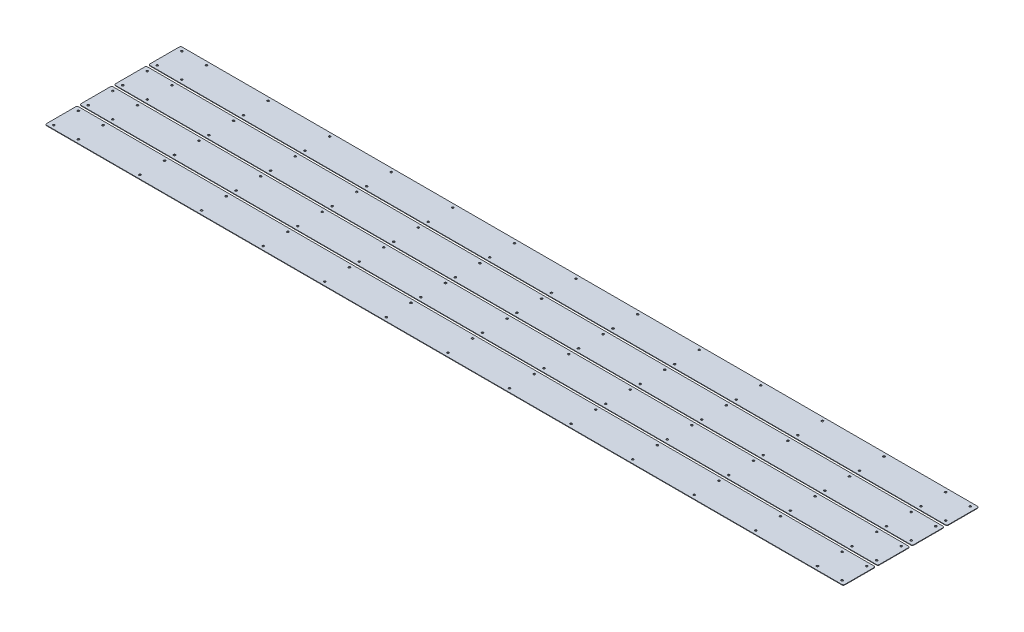
from build123d import *

# Parameters (mm, degrees)
SKETCH1_W           = 1620
SKETCH1_H           = 65
SKETCH1_R           = 2
BOSS_EXTRUDE1_DEPTH = 1
FILLET1_R           = 3
LPATTERN1_COUNT     = 4
LPATTERN1_PITCH     = 70


with BuildPart() as part:
    # Sketch1 → Boss-Extrude1 (new body)
    with BuildSketch(Plane(origin=(0, 0, 0), x_dir=(1, 0, 0), z_dir=(0, 1, 0))):
        with Locations((0, 25)):
            Rectangle(SKETCH1_W, SKETCH1_H)
        with Locations(Location((0, 0, 0), (0, 0, 270))):
            Circle(SKETCH1_R, mode=Mode.SUBTRACT)
        with Locations(Location((0, 50, 0), (0, 0, 270))):
            Circle(SKETCH1_R, mode=Mode.SUBTRACT)
        with Locations(Location((125, 0, 0), (0, 0, 270))):
            Circle(SKETCH1_R, mode=Mode.SUBTRACT)
        with Locations(Location((125, 50, 0), (0, 0, 270))):
            Circle(SKETCH1_R, mode=Mode.SUBTRACT)
        with Locations(Location((250, 0, 0), (0, 0, 270))):
            Circle(SKETCH1_R, mode=Mode.SUBTRACT)
        with Locations(Location((250, 50, 0), (0, 0, 270))):
            Circle(SKETCH1_R, mode=Mode.SUBTRACT)
        with Locations(Location((375, 0, 0), (0, 0, 270))):
            Circle(SKETCH1_R, mode=Mode.SUBTRACT)
        with Locations(Location((375, 50, 0), (0, 0, 270))):
            Circle(SKETCH1_R, mode=Mode.SUBTRACT)
        with Locations(Location((500, 0, 0), (0, 0, 270))):
            Circle(SKETCH1_R, mode=Mode.SUBTRACT)
        with Locations(Location((500, 50, 0), (0, 0, 270))):
            Circle(SKETCH1_R, mode=Mode.SUBTRACT)
        with Locations(Location((625, 0, 0), (0, 0, 270))):
            Circle(SKETCH1_R, mode=Mode.SUBTRACT)
        with Locations(Location((625, 50, 0), (0, 0, 270))):
            Circle(SKETCH1_R, mode=Mode.SUBTRACT)
        with Locations(Location((750, 0, 0), (0, 0, 270))):
            Circle(SKETCH1_R, mode=Mode.SUBTRACT)
        with Locations(Location((750, 50, 0), (0, 0, 270))):
            Circle(SKETCH1_R, mode=Mode.SUBTRACT)
        with Locations(Location((-125, 0, 0), (0, 0, 270))):
            Circle(SKETCH1_R, mode=Mode.SUBTRACT)
        with Locations(Location((-125, 50, 0), (0, 0, 270))):
            Circle(SKETCH1_R, mode=Mode.SUBTRACT)
        with Locations(Location((-250, 0, 0), (0, 0, 270))):
            Circle(SKETCH1_R, mode=Mode.SUBTRACT)
        with Locations(Location((-250, 50, 0), (0, 0, 270))):
            Circle(SKETCH1_R, mode=Mode.SUBTRACT)
        with Locations(Location((-375, 0, 0), (0, 0, 270))):
            Circle(SKETCH1_R, mode=Mode.SUBTRACT)
        with Locations(Location((-375, 50, 0), (0, 0, 270))):
            Circle(SKETCH1_R, mode=Mode.SUBTRACT)
        with Locations(Location((-500, 0, 0), (0, 0, 270))):
            Circle(SKETCH1_R, mode=Mode.SUBTRACT)
        with Locations(Location((-500, 50, 0), (0, 0, 270))):
            Circle(SKETCH1_R, mode=Mode.SUBTRACT)
        with Locations(Location((-625, 0, 0), (0, 0, 270))):
            Circle(SKETCH1_R, mode=Mode.SUBTRACT)
        with Locations(Location((-625, 50, 0), (0, 0, 270))):
            Circle(SKETCH1_R, mode=Mode.SUBTRACT)
        with Locations(Location((-750, 0, 0), (0, 0, 270))):
            Circle(SKETCH1_R, mode=Mode.SUBTRACT)
        with Locations(Location((-750, 50, 0), (0, 0, 270))):
            Circle(SKETCH1_R, mode=Mode.SUBTRACT)
        with Locations(Location((-800, 50, 0), (0, 0, 270))):
            Circle(SKETCH1_R, mode=Mode.SUBTRACT)
        with Locations(Location((-800, 0, 0), (0, 0, 270))):
            Circle(SKETCH1_R, mode=Mode.SUBTRACT)
        with Locations(Location((800, 50, 0), (0, 0, 270))):
            Circle(SKETCH1_R, mode=Mode.SUBTRACT)
        with Locations(Location((800, 0, 0), (0, 0, 270))):
            Circle(SKETCH1_R, mode=Mode.SUBTRACT)
    extrude(amount=BOSS_EXTRUDE1_DEPTH)

    # Fillet1
    fillet1_edges = [part.edges().sort_by_distance(p)[0] for p in [
        (810, 0.5, 7.5),
        (-810, 0.5, 7.5),
        (-810, 0.5, -57.5),
        (810, 0.5, -57.5),
    ]]
    fillet(fillet1_edges, radius=FILLET1_R)


with BuildPart() as lpattern1_1:
    # LPattern1: pattern copy
    add(part.part.moved(Location(Vector(0, 0, -1) * (1 * LPATTERN1_PITCH))))


with BuildPart() as lpattern1_2:
    # LPattern1: pattern copy
    add(part.part.moved(Location(Vector(0, 0, -1) * (2 * LPATTERN1_PITCH))))


with BuildPart() as lpattern1_3:
    # LPattern1: pattern copy
    add(part.part.moved(Location(Vector(0, 0, -1) * (3 * LPATTERN1_PITCH))))


solid = Compound([part.part, lpattern1_1.part, lpattern1_2.part, lpattern1_3.part])
